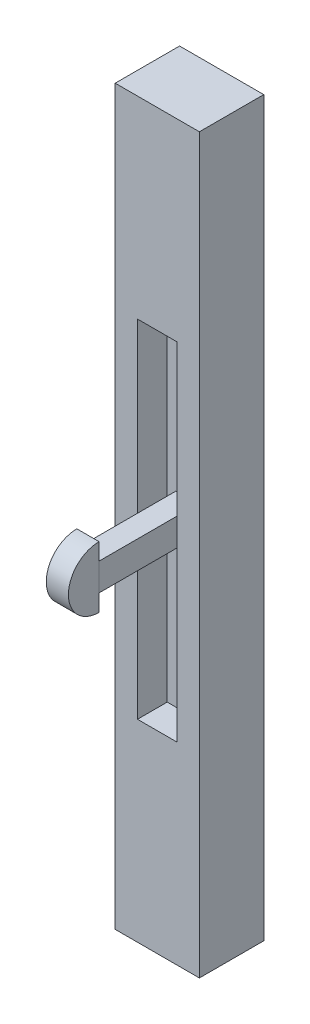
from build123d import *

# Parameters (mm, degrees)
SKETCH1_W           = 74
SKETCH1_H           = 8.5
BOSS_EXTRUDE1_DEPTH = 6.5
SKETCH2_W           = 4
SKETCH2_H           = 35
CUT_EXTRUDE1_DEPTH  = 3
SKETCH3_W           = 2.242776622
SKETCH3_H           = 2.782449956
BOSS_EXTRUDE2_DEPTH = 10
BOSS_EXTRUDE3_DEPTH = 1.12
BOSS_EXTRUDE5_START = 1.12
BOSS_EXTRUDE5_DEPTH = 1.12


with BuildPart() as part:
    # Sketch1 → Boss-Extrude1 (new body)
    with BuildSketch(Plane(origin=(0, 0, 0), x_dir=(0, 1, 0), z_dir=(0, 0, 1))):
        Rectangle(SKETCH1_W, SKETCH1_H)
    extrude(amount=BOSS_EXTRUDE1_DEPTH)

    # Sketch2 → Cut-Extrude1 (cut)
    with BuildSketch(Plane.XY.offset(6.5)):
        Rectangle(SKETCH2_W, SKETCH2_H)
    extrude(amount=-CUT_EXTRUDE1_DEPTH, mode=Mode.SUBTRACT)

    # Sketch3 → Boss-Extrude2 (add)
    with BuildSketch(Plane.XY.offset(3.5)):
        Rectangle(SKETCH3_W, SKETCH3_H)
    extrude(amount=BOSS_EXTRUDE2_DEPTH)

    # Sketch4 → Boss-Extrude3 (add)
    with BuildSketch(Plane.YZ):
        with BuildLine():
            Line((-3.093095713, 13.5), (3.093095713, 13.5))
            ThreePointArc((3.093095713, 13.5), (0, 16.593095713), (-3.093095713, 13.5))
        make_face()
    extrude(amount=BOSS_EXTRUDE3_DEPTH)

    # Sketch10 → Boss-Extrude5 (add)
    with BuildSketch(Plane(origin=(0, 0, 0), x_dir=(0, -1, 0), z_dir=(-1, 0, 0)).offset(BOSS_EXTRUDE5_START)):
        with BuildLine():
            Line((3.093095713, 13.5), (-3.093095713, 13.5))
            ThreePointArc((-3.093095713, 13.5), (0, 16.593095713), (3.093095713, 13.5))
        make_face()
    extrude(amount=-BOSS_EXTRUDE5_DEPTH)


solid = part.part
